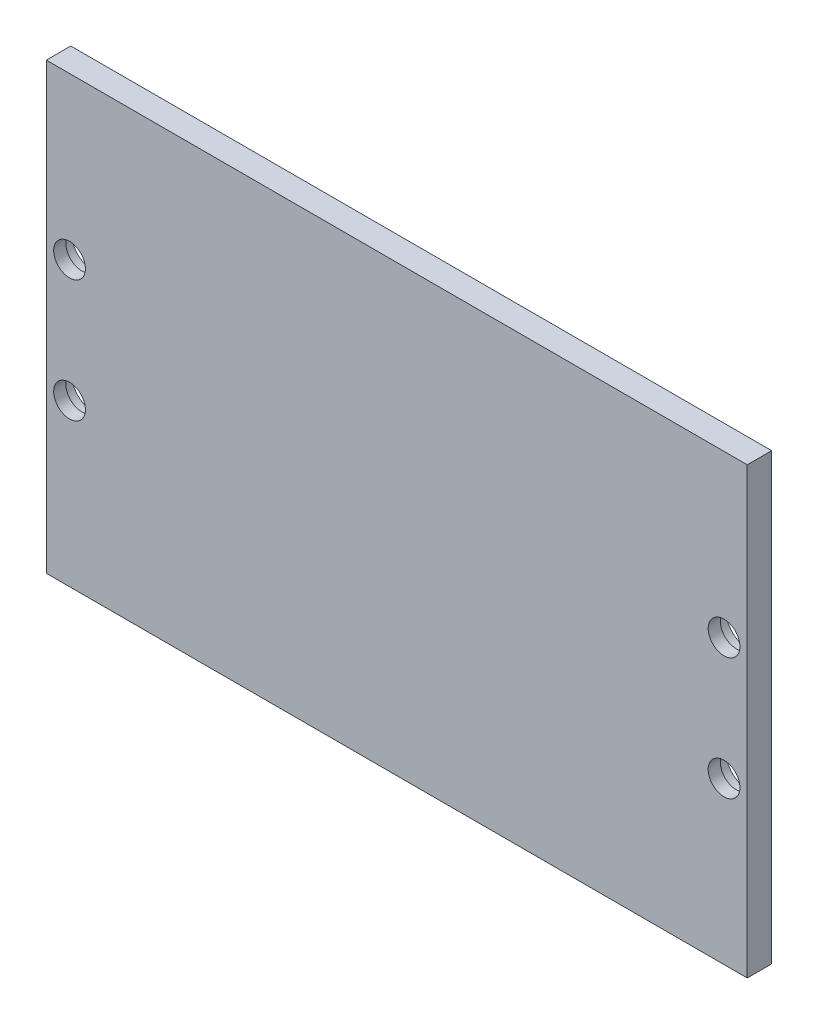
from build123d import *

# Parameters (mm, degrees)
SKETCH_1_W          = 28.7
SKETCH_1_H          = 18.2
EXTRUDE_1_DEPTH     = 1
SKETCH_2_R          = 0.925
CUT_EXTRUDE_1_DEPTH = 49.82096668
SKETCH_3_R          = 0.925
SKETCH_3_R_2        = 0.65
EXTRUDE_2_DEPTH     = 0.5


with BuildPart() as part:
    # 草圖1 → 填料-伸長1 (new body)
    with BuildSketch(Plane.XY):
        with Locations((12.170607589, 31.877361563)):
            Rectangle(SKETCH_1_W, SKETCH_1_H)
    extrude(amount=EXTRUDE_1_DEPTH)

    # 草圖2 → 除料-伸長1 (cut, through all)
    with BuildSketch(Plane.XY.offset(1)):
        with Locations((25.570607589, 34.377361563)):
            Circle(SKETCH_2_R)
        with Locations((25.570607589, 29.377361563)):
            Circle(SKETCH_2_R)
        with Locations((-1.229392411, 34.377361563)):
            Circle(SKETCH_2_R)
        with Locations((-1.229392411, 29.377361563)):
            Circle(SKETCH_2_R)
    extrude(amount=-CUT_EXTRUDE_1_DEPTH, mode=Mode.SUBTRACT)

    # 草圖3 → 填料-伸長2 (add)
    # profile 1 of 4: a face of its own
    with BuildSketch(Plane(origin=(0, 0, 1), x_dir=(-1, 0, 0), z_dir=(0, 0, -1))):
        with Locations(Location((1.229392411, 34.377361563, 0), (0, 0, 180))):
            Circle(SKETCH_3_R)
        with Locations(Location((1.229392411, 34.377361563, 0), (0, 0, 90))):
            Circle(SKETCH_3_R_2, mode=Mode.SUBTRACT)
    # profile 2 of 4: a face of its own
    with BuildSketch(Plane(origin=(0, 0, 1), x_dir=(-1, 0, 0), z_dir=(0, 0, -1))):
        with Locations(Location((1.229392411, 29.377361563, 0), (0, 0, 180))):
            Circle(SKETCH_3_R)
        with Locations(Location((1.229392411, 29.377361563, 0), (0, 0, 270))):
            Circle(SKETCH_3_R_2, mode=Mode.SUBTRACT)
    # profile 3 of 4: a face of its own
    with BuildSketch(Plane(origin=(0, 0, 1), x_dir=(-1, 0, 0), z_dir=(0, 0, -1))):
        with Locations(Location((-25.570607589, 29.377361563, 0), (0, 0, 180))):
            Circle(SKETCH_3_R)
        with Locations(Location((-25.570607589, 29.377361563, 0), (0, 0, 90))):
            Circle(SKETCH_3_R_2, mode=Mode.SUBTRACT)
    # profile 4 of 4: a face of its own
    with BuildSketch(Plane(origin=(0, 0, 1), x_dir=(-1, 0, 0), z_dir=(0, 0, -1))):
        with Locations(Location((-25.570607589, 34.377361563, 0), (0, 0, 180))):
            Circle(SKETCH_3_R)
        with Locations(Location((-25.570607589, 34.377361563, 0), (0, 0, 270))):
            Circle(SKETCH_3_R_2, mode=Mode.SUBTRACT)
    extrude(amount=EXTRUDE_2_DEPTH)


solid = part.part
